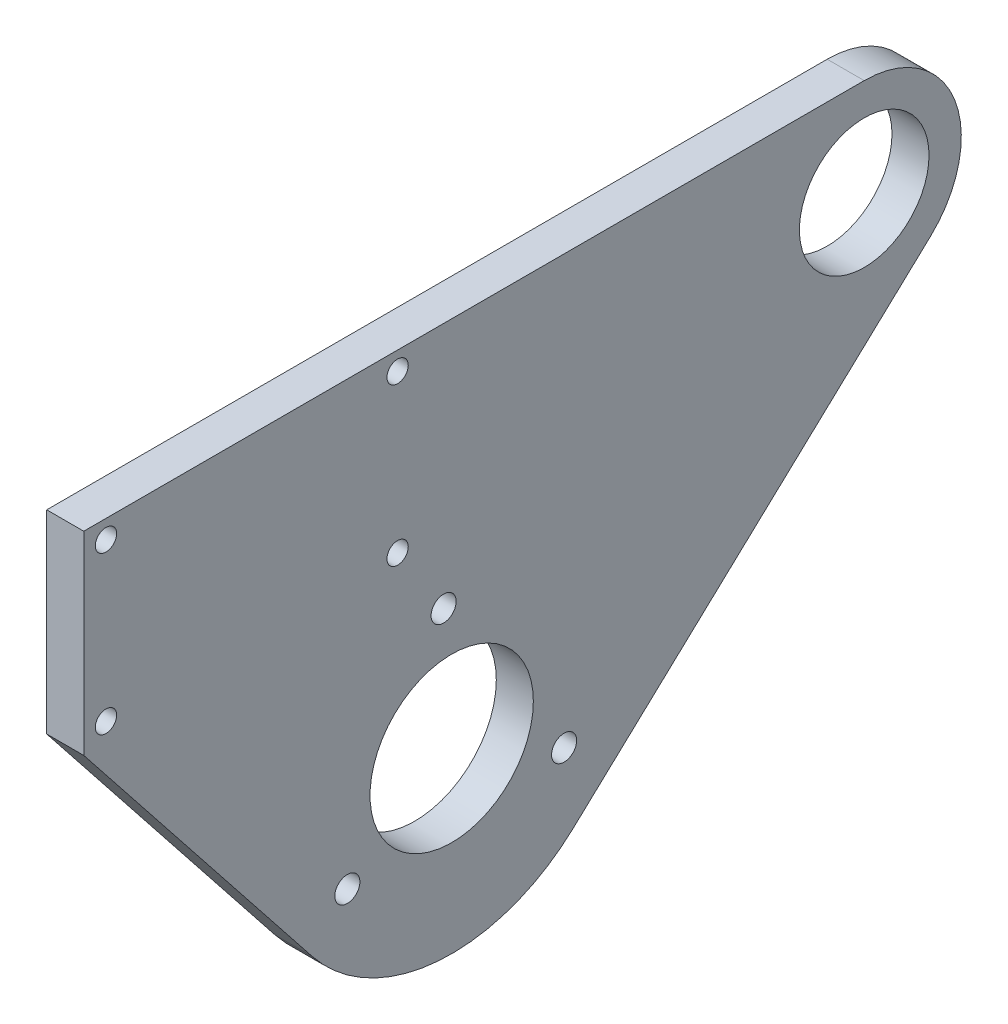
from build123d import *

# Parameters (mm, degrees)
SKETCH1_R             = 14
SKETCH1_R_2           = 11.1125
BOSS_EXTRUDE1_DEPTH   = 3.175
F_6_CLEARANCE_HOLE1_D = 3.6576
M4_CLEARANCE_HOLE1_D  = 4.3


with BuildPart() as part:
    # Sketch1 → Boss-Extrude1 (new, symmetric)
    with BuildSketch(Plane(origin=(0, 0, 0), x_dir=(0, 0, -1), z_dir=(1, 0, 0))):
        with BuildLine():
            Line((-133.81, -16.645), (-94.632187648, -66.087166556))
            ThreePointArc((-94.632187648, -66.087166556), (-72.998034274, -77.560353063), (-49.900079745, -69.426774672))
            Line((-49.900079745, -69.426774672), (11.366191703, -12.160004571))
            ThreePointArc((11.366191703, -12.160004571), (15.483205435, 6.109531443), (0, 16.645))
            Line((0, 16.645), (-133.81, 16.645))
            Line((-133.81, 16.645), (-133.81, -16.645))
        make_face()
        with Locations((-70.72728593, -47.145)):
            Circle(SKETCH1_R, mode=Mode.SUBTRACT)
        Circle(SKETCH1_R_2, mode=Mode.SUBTRACT)
    extrude(amount=BOSS_EXTRUDE1_DEPTH, both=True)

    # #6 Clearance Hole1 (through all)
    with Locations(Plane(origin=(3.175, 0, 0), x_dir=(0, 0, -1), z_dir=(1, 0, 0))):
        with Locations((-80, -13.475), (-80, 13.475), (-130, 13.475), (-130, -13.475)):
            Hole(F_6_CLEARANCE_HOLE1_D / 2)

    # M4 Clearance Hole1 (through all)
    with Locations(Plane(origin=(3.175, 0, 0), x_dir=(0, 0, -1), z_dir=(1, 0, 0))):
        with Locations((-72.109641, -25.689485686), (-88.617128841, -59.069911765), (-51.455087948, -56.675602549)):
            Hole(M4_CLEARANCE_HOLE1_D / 2)


solid = part.part
